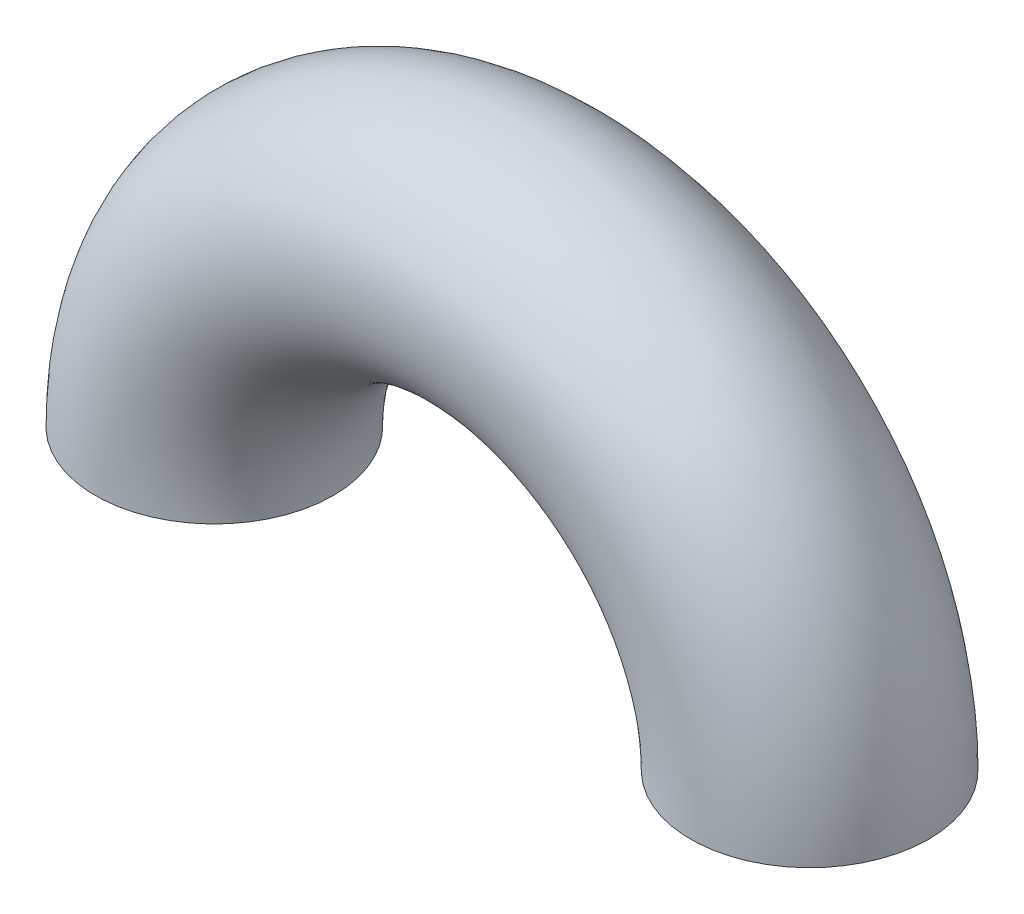
from build123d import *

# Parameters (mm, degrees)
SWEEP_THIN1_PROFILE_R   = 5
SWEEP_THIN1_PROFILE_R_2 = 4.5


with BuildPart() as part:
    # Sweep-Thin1: sweep along a path in Sketch1
    with BuildLine(Plane.XY) as sweep_thin1_path:
        ThreePointArc((-12.5, 0), (0, 12.5), (12.5, 0))
    # Sweep-Thin1 profile (on start of the path) → Sweep-Thin1 (sweep)
    with BuildSketch(Plane(origin=(-12.5, 0, 0), x_dir=(0, 0, 1), z_dir=(0, 1, 0))):
        Circle(SWEEP_THIN1_PROFILE_R)
        Circle(SWEEP_THIN1_PROFILE_R_2, mode=Mode.SUBTRACT)
    sweep(path=sweep_thin1_path.line)


solid = part.part
